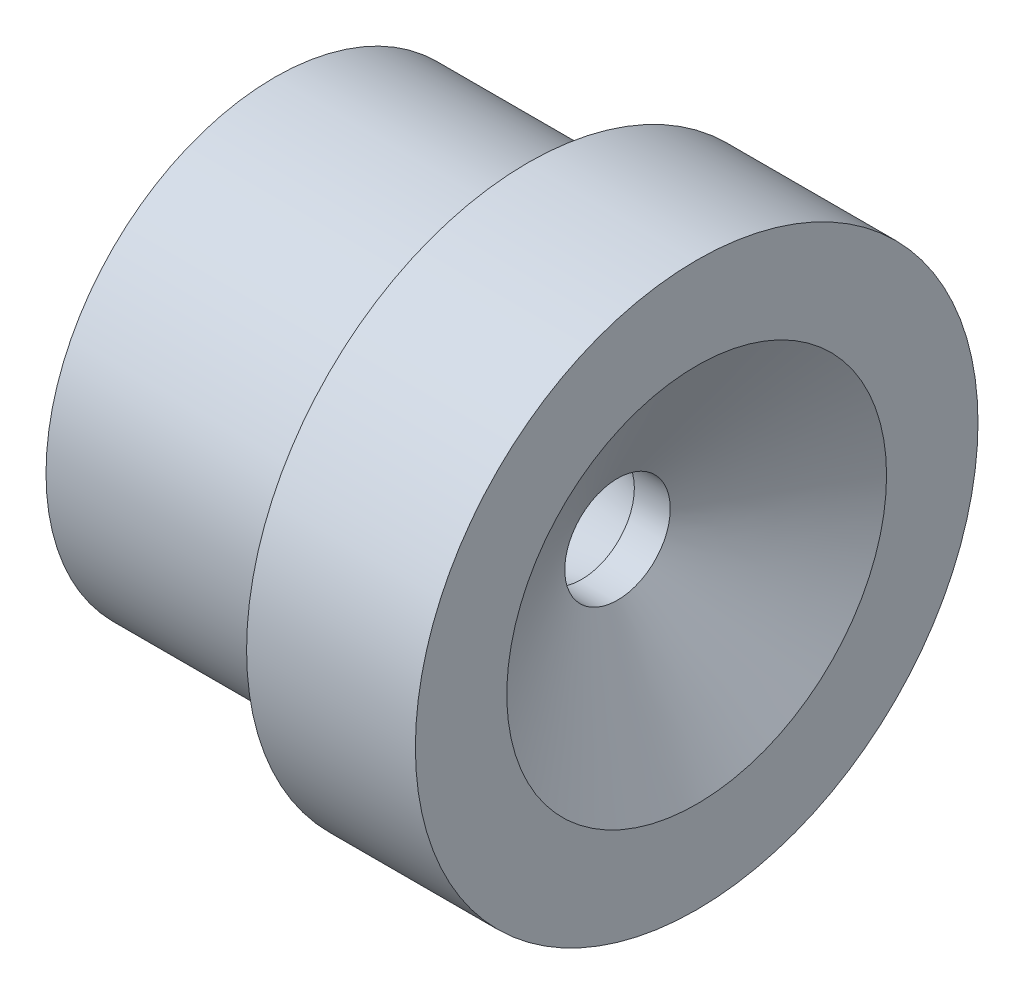
from build123d import *


with BuildPart() as part:
    # Sketch1 → Revolve1 (revolve)
    with BuildSketch(Plane(origin=(0, 0, 0), x_dir=(1, 0, 0), z_dir=(0, 1, 0)), mode=Mode.PRIVATE) as revolve1_sk:
        Polygon((0, 0), (0, 4.1275), (-3.574519854, 10.31875), (-5.195039854, 10.31875), (-19.05, 6.606324618), (-19.05, 2.3749), (-7.62, 2.3749), (-7.62, 0), align=None)
    revolve(revolve1_sk.sketch.rotate(Axis((5.118729701, 0, -12.7), (-1, 0, 0)), 180), axis=Axis((5.118729701, 0, -12.7), (-1, 0, 0)))


solid = part.part
